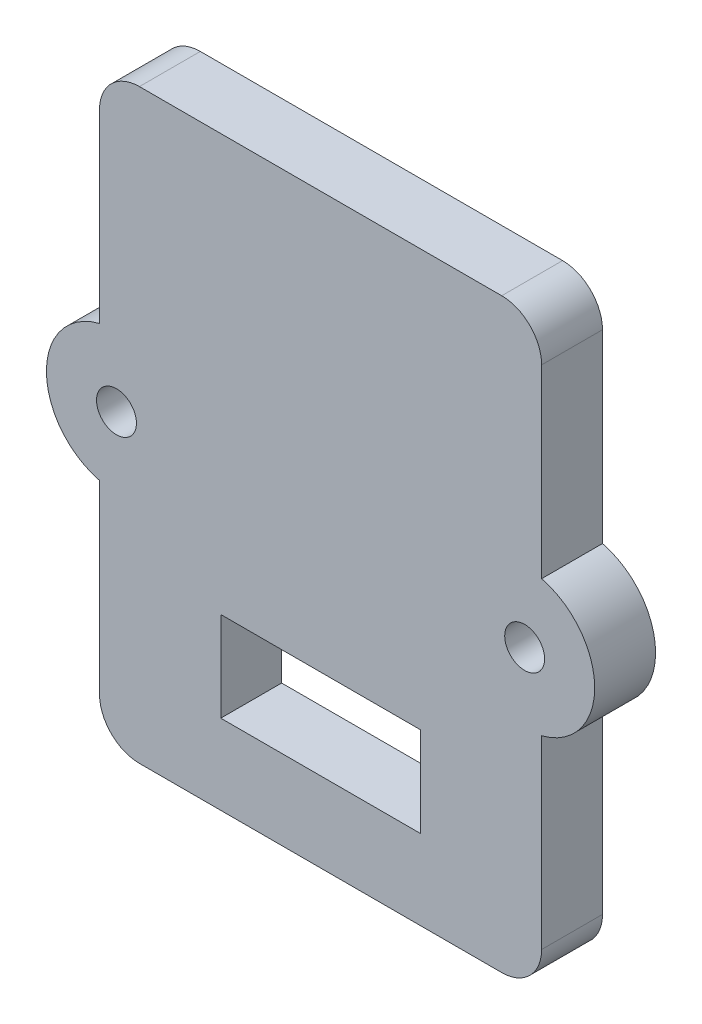
from build123d import *

# Parameters (mm, degrees)
SKETCH2_R           = 1
SKETCH2_W           = 10
SKETCH2_H           = 4.5
BOSS_EXTRUDE2_DEPTH = 3.05


with BuildPart() as part:
    # Sketch2 → Boss-Extrude2 (new body)
    with BuildSketch(Plane.XY):
        with BuildLine():
            Line((-11.075, 15.855524923), (-11.075, 25.133587826))
            ThreePointArc((-11.075, 25.133587826), (-10.489213562, 26.547801388), (-9.075, 27.133587826))
            Line((-9.075, 27.133587826), (9.075, 27.133587826))
            ThreePointArc((9.075, 27.133587826), (10.489213562, 26.547801388), (11.075, 25.133587826))
            Line((11.075, 25.133587826), (11.075, 15.855524923))
            ThreePointArc((11.075, 15.855524923), (13.735, 12.45), (11.075, 9.044475077))
            Line((11.075, 9.044475077), (11.075, -0.233587826))
            ThreePointArc((11.075, -0.233587826), (10.489213562, -1.647801388), (9.075, -2.233587826))
            Line((9.075, -2.233587826), (-9.075, -2.233587826))
            ThreePointArc((-9.075, -2.233587826), (-10.489213562, -1.647801388), (-11.075, -0.233587826))
            Line((-11.075, -0.233587826), (-11.075, 9.044475077))
            ThreePointArc((-11.075, 9.044475077), (-13.735, 12.45), (-11.075, 15.855524923))
        make_face()
        with Locations((-10.225, 12.45)):
            Circle(SKETCH2_R, mode=Mode.SUBTRACT)
        with Locations(Location((10.225, 12.45, 0), (0, 0, 180))):
            Circle(SKETCH2_R, mode=Mode.SUBTRACT)
        with Locations((0, 4.016412174)):
            Rectangle(SKETCH2_W, SKETCH2_H, mode=Mode.SUBTRACT)
    extrude(amount=BOSS_EXTRUDE2_DEPTH)


solid = part.part
